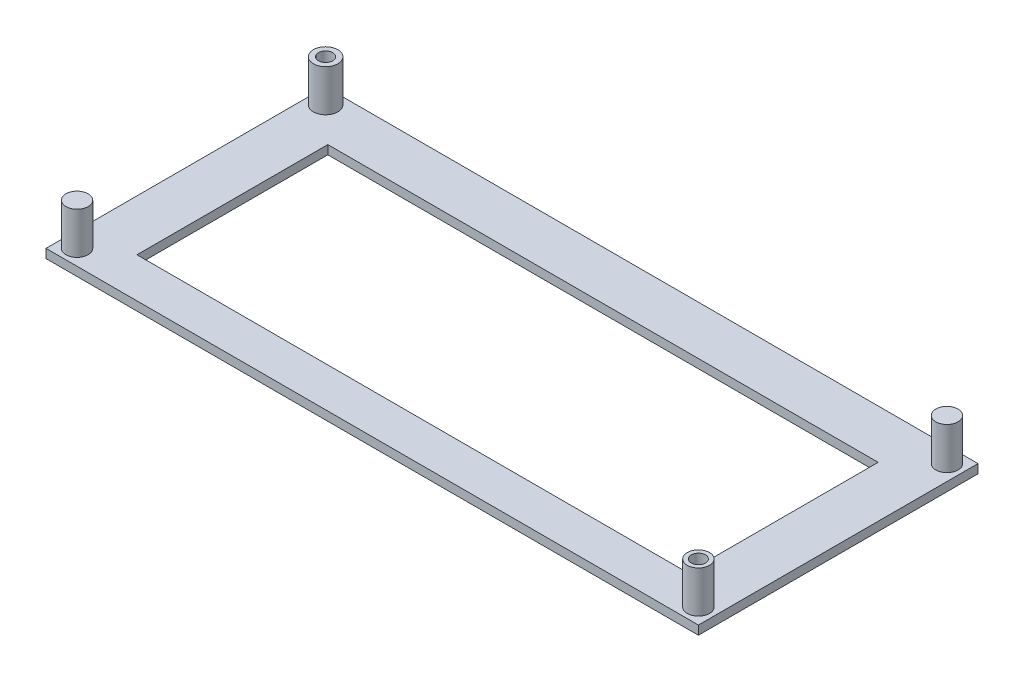
from build123d import *

# Parameters (mm, degrees)
SKIZZE3_W                       = 147
SKIZZE3_H                       = 63
AUFSATZ_LINEAR_AUSTRAGEN2_DEPTH = 2
SKIZZE4_W                       = 124
SKIZZE4_H                       = 43
SCHNITT_LINEAR_AUSTRAGEN1_DEPTH = 2
SKIZZE5_R                       = 2.752378696
AUFSATZ_LINEAR_AUSTRAGEN3_DEPTH = 9.4
SKIZZE6_R                       = 1.6
SCHNITT_LINEAR_AUSTRAGEN2_DEPTH = 11.4
SKIZZE7_R                       = 2.5
AUFSATZ_LINEAR_AUSTRAGEN4_DEPTH = 9.4
SKIZZE8_R                       = 1.6
SCHNITT_LINEAR_AUSTRAGEN3_DEPTH = 11.4
SKIZZE9_R                       = 2.5
AUFSATZ_LINEAR_AUSTRAGEN5_DEPTH = 9.4


with BuildPart() as part:
    # Skizze3 → Aufsatz-Linear austragen2 (new body)
    with BuildSketch(Plane(origin=(0, 0, 0), x_dir=(1, 0, 0), z_dir=(0, 1, 0))):
        with Locations((73.5, 31.5)):
            Rectangle(SKIZZE3_W, SKIZZE3_H)
    extrude(amount=AUFSATZ_LINEAR_AUSTRAGEN2_DEPTH)

    # Skizze4 → Schnitt-Linear austragen1 (cut)
    with BuildSketch(Plane(origin=(0, 2, 0), x_dir=(1, 0, 0), z_dir=(0, 1, 0))):
        with Locations((73.5, 30.5)):
            Rectangle(SKIZZE4_W, SKIZZE4_H)
    extrude(amount=-SCHNITT_LINEAR_AUSTRAGEN1_DEPTH, mode=Mode.SUBTRACT)

    # Skizze5 → Aufsatz-Linear austragen3 (add)
    with BuildSketch(Plane(origin=(0, 2, 0), x_dir=(1, 0, 0), z_dir=(0, 1, 0))):
        with Locations(Location((3.5, 59.5, 0), (0, 0, 270))):
            Circle(SKIZZE5_R)
    extrude(amount=AUFSATZ_LINEAR_AUSTRAGEN3_DEPTH)

    # Skizze6 → Schnitt-Linear austragen2 (cut)
    with BuildSketch(Plane(origin=(0, 11.4, 0), x_dir=(1, 0, 0), z_dir=(0, 1, 0))):
        with Locations(Location((3.5, 59.5, 0), (0, 0, 270))):
            Circle(SKIZZE6_R)
    extrude(amount=-SCHNITT_LINEAR_AUSTRAGEN2_DEPTH, mode=Mode.SUBTRACT)

    # Skizze7 → Aufsatz-Linear austragen4 (add)
    with BuildSketch(Plane(origin=(0, 2, 0), x_dir=(1, 0, 0), z_dir=(0, 1, 0))):
        with Locations(Location((143.5, 3.5, 0), (0, 0, 270))):
            Circle(SKIZZE7_R)
    extrude(amount=AUFSATZ_LINEAR_AUSTRAGEN4_DEPTH)

    # Skizze8 → Schnitt-Linear austragen3 (cut)
    with BuildSketch(Plane(origin=(0, 11.4, 0), x_dir=(1, 0, 0), z_dir=(0, 1, 0))):
        with Locations(Location((143.5, 3.5, 0), (0, 0, 270))):
            Circle(SKIZZE8_R)
    extrude(amount=-SCHNITT_LINEAR_AUSTRAGEN3_DEPTH, mode=Mode.SUBTRACT)

    # Skizze9 → Aufsatz-Linear austragen5 (add)
    with BuildSketch(Plane(origin=(0, 2, 0), x_dir=(1, 0, 0), z_dir=(0, 1, 0))):
        with Locations(Location((143.5, 59.5, 0), (0, 0, 270))):
            Circle(SKIZZE9_R)
        with Locations(Location((3.5, 3.5, 0), (0, 0, 270))):
            Circle(SKIZZE9_R)
    extrude(amount=AUFSATZ_LINEAR_AUSTRAGEN5_DEPTH)


solid = part.part
